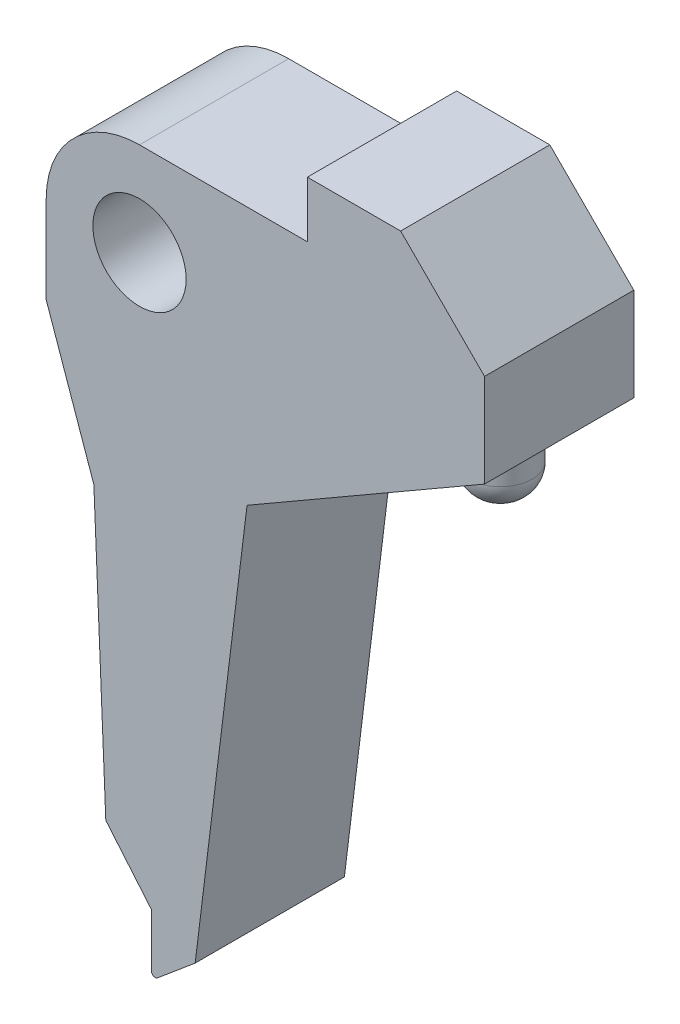
from build123d import *

# Parameters (mm, degrees)
SKETCH_1_R          = 2.5
EXTRUDE_1_DEPTH     = 8
CUT_EXTRUDE_1_REACH = 39.599
SKETCH_3_R          = 2.5
SKETCH_4_R          = 1.7
EXTRUDE_2_DEPTH     = 4
FILLET_1_R          = 1.5


with BuildPart() as part:
    # 스케치1 → 보스-돌출1 (new body)
    with BuildSketch(Plane.XY):
        with BuildLine():
            Line((0, 5), (9, 5))
            Line((9, 5), (9, 8))
            Line((9, 8), (14, 8))
            Line((14, 8), (18.5, 3.5))
            Line((18.5, 3.5), (18.5, -1.5))
            Line((18.5, -1.5), (12.133141101, -5.175907699))
            Line((12.133141101, -5.175907699), (5.766282201, -8.851815399))
            Line((5.766282201, -8.851815399), (4.500770003, -19.158585151))
            Line((4.500770003, -19.158585151), (2.9854348, -31.5))
            Line((2.9854348, -31.5), (0.968172025, -33.193012598))
            ThreePointArc((0.968172025, -33.193012598), (0.755084879, -33.221081572), (0.63959988, -33.039815981))
            Line((0.63959988, -33.039815981), (0.63959988, -30.183726788))
            Line((0.63959988, -30.183726788), (-1.805734914, -27.269490262))
            Line((-1.805734914, -27.269490262), (-2.445573418, -12))
            Line((-2.445573418, -12), (-5, -4.696574134))
            Line((-5, -4.696574134), (-5, 0))
            ThreePointArc((-5, 0), (-3.535533906, 3.535533906), (0, 5))
        make_face()
        Circle(SKETCH_1_R, mode=Mode.SUBTRACT)
    extrude(amount=EXTRUDE_1_DEPTH)

    # 컷-돌출1: up to this plane
    cut_extrude_1_end = Plane(origin=(18.5, -1.5, 8), z_dir=(-0.5000000000000017, 0.8660254037844378, 0))
    # 스케치3 → 컷-돌출1 (cut, up to the surface)
    with BuildSketch(Plane(origin=(0, -1.5, 0), x_dir=(1, 0, 0), z_dir=(0, 1, 0)), mode=Mode.PRIVATE) as cut_extrude_1_sk1:
        with Locations(Location((15.349608759, -4, 0), (0, 0, 270))):
            Circle(SKETCH_3_R)
    cut_extrude_1_tool1 = split(extrude(cut_extrude_1_sk1.sketch, amount=-CUT_EXTRUDE_1_REACH, mode=Mode.PRIVATE), bisect_by=cut_extrude_1_end, keep=Keep.BOTH, mode=Mode.PRIVATE)
    add(cut_extrude_1_tool1.solids().sort_by_distance((15.349609, -1.5, 4))[0], mode=Mode.SUBTRACT)

    # 스케치4 → 보스-돌출2 (add)
    with BuildSketch(Plane.XZ.offset(1.5)):
        with Locations(Location((15.349608759, 4, 0), (0, 0, 90))):
            Circle(SKETCH_4_R)
    extrude(amount=EXTRUDE_2_DEPTH)

    # 필렛1
    fillet_1_edges = [part.edges().sort_by_distance(p)[0] for p in [
        (15.349608759, -5.5, 2.3),
    ]]
    fillet(fillet_1_edges, radius=FILLET_1_R)


solid = part.part
